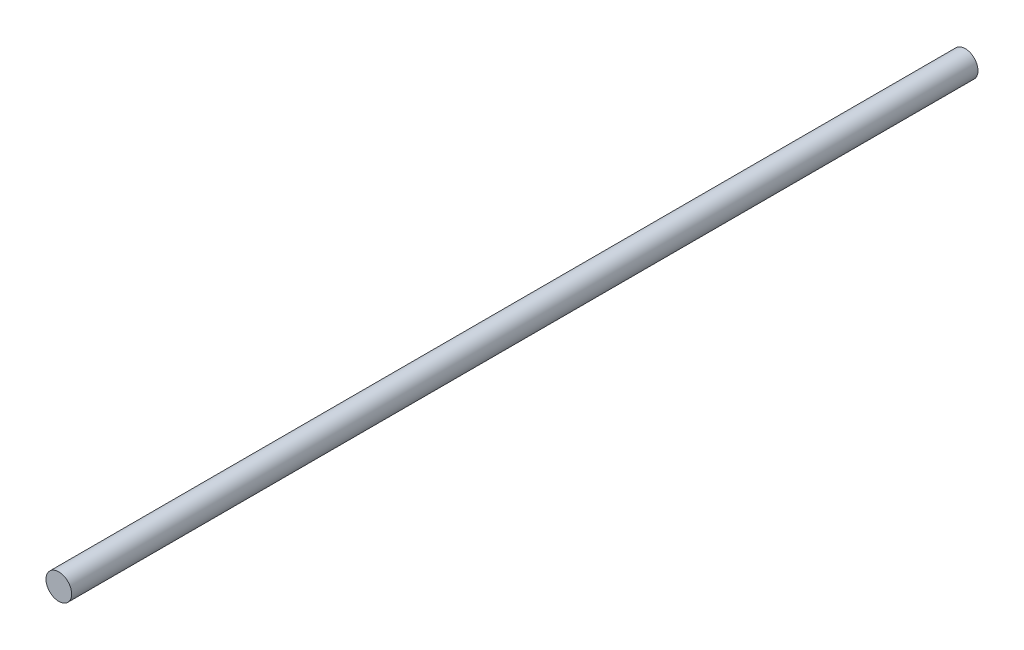
from build123d import *

# Parameters (mm, degrees)
ESQUISSE1_R        = 2.39
BOSS_EXTRU_1_DEPTH = 169


with BuildPart() as part:
    # Esquisse1 → Boss.-Extru.1 (new body)
    with BuildSketch(Plane.XY):
        Circle(ESQUISSE1_R)
    extrude(amount=BOSS_EXTRU_1_DEPTH)


solid = part.part
